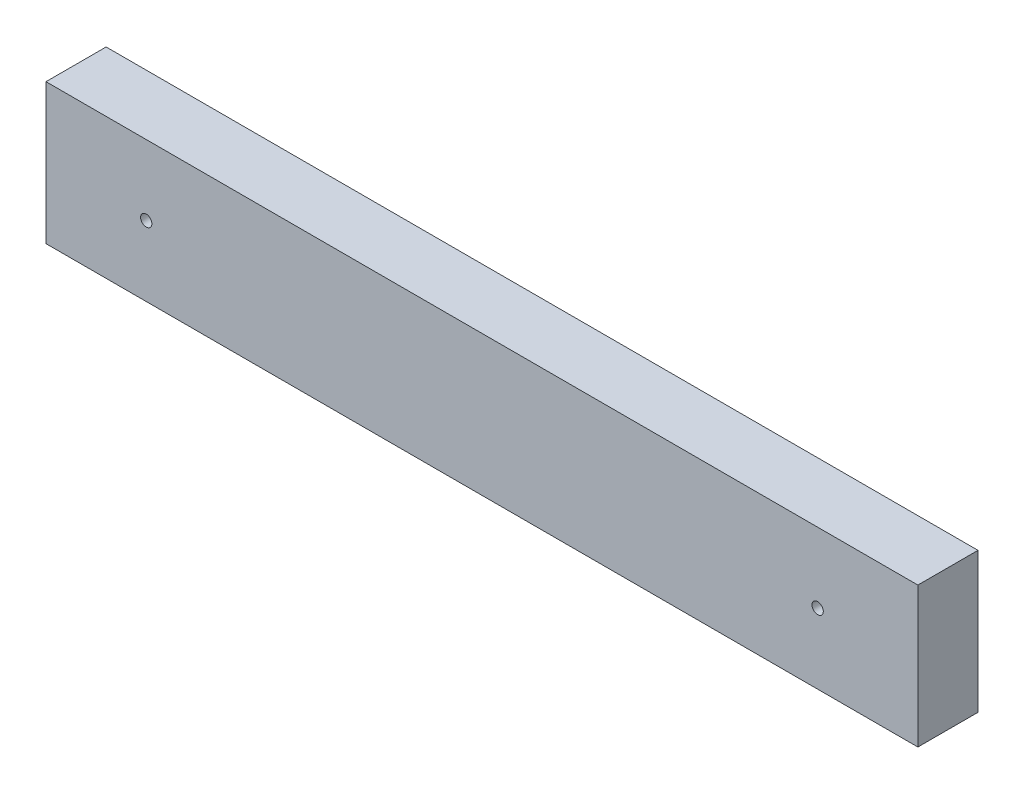
from build123d import *

# Parameters (mm, degrees)
SKETCH1_W           = 38.1
SKETCH1_H           = 88.9
BOSS_EXTRUDE1_DEPTH = 552.45
SKETCH2_R           = 3.571875
CUT_EXTRUDE1_DEPTH  = 561.852763655


with BuildPart() as part:
    # Sketch1 → Boss-Extrude1 (new body)
    with BuildSketch(Plane(origin=(0, 0, 0), x_dir=(0, 0, -1), z_dir=(1, 0, 0))):
        with Locations((19.05, 44.45)):
            Rectangle(SKETCH1_W, SKETCH1_H)
    extrude(amount=BOSS_EXTRUDE1_DEPTH)

    # Sketch2 → Cut-Extrude1 (cut, through all)
    with BuildSketch(Plane.XY):
        with Locations((63.5, 44.45)):
            Circle(SKETCH2_R)
        with Locations((488.95, 44.45)):
            Circle(SKETCH2_R)
    extrude(amount=-CUT_EXTRUDE1_DEPTH, mode=Mode.SUBTRACT)


solid = part.part
